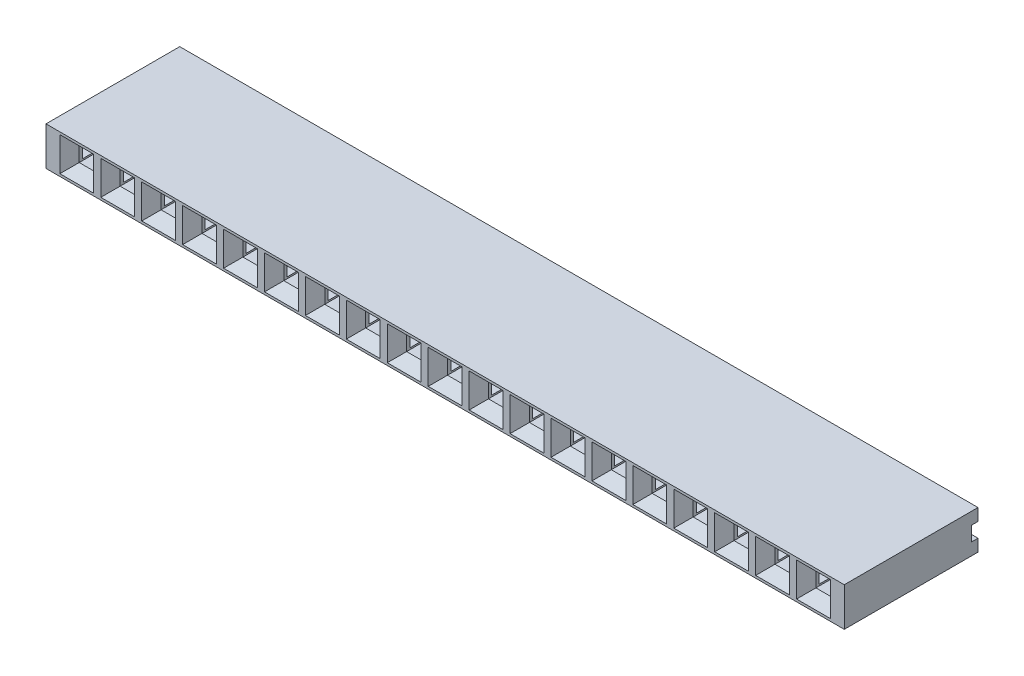
from build123d import *

# Parameters (mm, degrees)
EXTRUDE_710_DEPTH         = 6.7
EXTRUDE_710_DEPTH_BACK    = 0.4
SKETCH_233_W              = 2.54
SKETCH_233_H              = 2.4
SKETCH_764_W              = 2.54
SKETCH_764_H              = 0.75
EXTRUDE_1143_DEPTH        = 0.4
SKETCH_1197_W             = 2.54
SKETCH_1197_H             = 2.4
SKETCH_1197_W_2           = 0.9
SKETCH_1197_H_2           = 0.9
EXTRUDE_1482_DEPTH        = 0.8
CHAMFER_1543_SIZE         = 0.6
PATTERN_LINEAR_1669_COUNT = 19
PATTERN_LINEAR_1669_PITCH = 2.54
EXTRUDE_1_DEPTH           = 0.64
EXTRUDE_START             = -48.9
EXTRUDE_2_DEPTH           = 0.64


with BuildPart() as part:
    # Sketch 233 → Extrude 710 (new, two sides: drawn at the far end of the back side and taken through both)
    with BuildSketch(Plane.XY.offset(-EXTRUDE_710_DEPTH_BACK)):
        Rectangle(SKETCH_233_W, SKETCH_233_H)
        Polygon((-1, 0.35), (-0.45, 0.35), (-0.45, 0.45), (0.45, 0.45), (0.45, 0.35), (1, 0.35), (1, -0.35), (0.45, -0.35), (0.45, -0.45), (-0.45, -0.45), (-0.45, -0.35), (-1, -0.35), align=None, mode=Mode.SUBTRACT)
    extrude(amount=EXTRUDE_710_DEPTH + EXTRUDE_710_DEPTH_BACK)

    # Sketch 764 → Extrude 1143 (add)
    with BuildSketch(Plane(origin=(0, 0, -0.4), x_dir=(-1, 0, 0), z_dir=(0, 0, -1))):
        with Locations((0, -0.825)):
            Rectangle(SKETCH_764_W, SKETCH_764_H)
        with Locations((0, 0.825)):
            Rectangle(SKETCH_764_W, SKETCH_764_H)
    extrude(amount=EXTRUDE_1143_DEPTH)

    # Sketch 1197 → Extrude 1482 (add)
    with BuildSketch(Plane.XY.offset(6.7)):
        Rectangle(SKETCH_1197_W, SKETCH_1197_H)
        Rectangle(SKETCH_1197_W_2, SKETCH_1197_H_2, mode=Mode.SUBTRACT)
    extrude(amount=EXTRUDE_1482_DEPTH)

    # Chamfer 1543
    chamfer_1543_edges = [part.edges().sort_by_distance(p)[0] for p in [
        (0.45, 0, 7.5),
        (0, 0.45, 7.5),
        (-0.45, 0, 7.5),
        (0, -0.45, 7.5),
    ]]
    chamfer(chamfer_1543_edges, length=CHAMFER_1543_SIZE)


with BuildPart() as pattern_linear_1669_1:
    # Pattern Linear 1669: pattern copy
    add(part.part.moved(Location(Vector(-1, 0, 0) * (1 * PATTERN_LINEAR_1669_PITCH))))


with BuildPart() as pattern_linear_1669_2:
    # Pattern Linear 1669: pattern copy
    add(part.part.moved(Location(Vector(-1, 0, 0) * (2 * PATTERN_LINEAR_1669_PITCH))))


with BuildPart() as pattern_linear_1669_3:
    # Pattern Linear 1669: pattern copy
    add(part.part.moved(Location(Vector(-1, 0, 0) * (3 * PATTERN_LINEAR_1669_PITCH))))


with BuildPart() as pattern_linear_1669_4:
    # Pattern Linear 1669: pattern copy
    add(part.part.moved(Location(Vector(-1, 0, 0) * (4 * PATTERN_LINEAR_1669_PITCH))))


with BuildPart() as pattern_linear_1669_5:
    # Pattern Linear 1669: pattern copy
    add(part.part.moved(Location(Vector(-1, 0, 0) * (5 * PATTERN_LINEAR_1669_PITCH))))


with BuildPart() as pattern_linear_1669_6:
    # Pattern Linear 1669: pattern copy
    add(part.part.moved(Location(Vector(-1, 0, 0) * (6 * PATTERN_LINEAR_1669_PITCH))))


with BuildPart() as pattern_linear_1669_7:
    # Pattern Linear 1669: pattern copy
    add(part.part.moved(Location(Vector(-1, 0, 0) * (7 * PATTERN_LINEAR_1669_PITCH))))


with BuildPart() as pattern_linear_1669_8:
    # Pattern Linear 1669: pattern copy
    add(part.part.moved(Location(Vector(-1, 0, 0) * (8 * PATTERN_LINEAR_1669_PITCH))))


with BuildPart() as pattern_linear_1669_9:
    # Pattern Linear 1669: pattern copy
    add(part.part.moved(Location(Vector(-1, 0, 0) * (9 * PATTERN_LINEAR_1669_PITCH))))


with BuildPart() as pattern_linear_1669_10:
    # Pattern Linear 1669: pattern copy
    add(part.part.moved(Location(Vector(-1, 0, 0) * (10 * PATTERN_LINEAR_1669_PITCH))))


with BuildPart() as pattern_linear_1669_11:
    # Pattern Linear 1669: pattern copy
    add(part.part.moved(Location(Vector(-1, 0, 0) * (11 * PATTERN_LINEAR_1669_PITCH))))


with BuildPart() as pattern_linear_1669_12:
    # Pattern Linear 1669: pattern copy
    add(part.part.moved(Location(Vector(-1, 0, 0) * (12 * PATTERN_LINEAR_1669_PITCH))))


with BuildPart() as pattern_linear_1669_13:
    # Pattern Linear 1669: pattern copy
    add(part.part.moved(Location(Vector(-1, 0, 0) * (13 * PATTERN_LINEAR_1669_PITCH))))


with BuildPart() as pattern_linear_1669_14:
    # Pattern Linear 1669: pattern copy
    add(part.part.moved(Location(Vector(-1, 0, 0) * (14 * PATTERN_LINEAR_1669_PITCH))))


with BuildPart() as pattern_linear_1669_15:
    # Pattern Linear 1669: pattern copy
    add(part.part.moved(Location(Vector(-1, 0, 0) * (15 * PATTERN_LINEAR_1669_PITCH))))


with BuildPart() as pattern_linear_1669_16:
    # Pattern Linear 1669: pattern copy
    add(part.part.moved(Location(Vector(-1, 0, 0) * (16 * PATTERN_LINEAR_1669_PITCH))))


with BuildPart() as pattern_linear_1669_17:
    # Pattern Linear 1669: pattern copy
    add(part.part.moved(Location(Vector(-1, 0, 0) * (17 * PATTERN_LINEAR_1669_PITCH))))


with BuildPart() as pattern_linear_1669_18:
    # Pattern Linear 1669: pattern copy
    add(part.part.moved(Location(Vector(-1, 0, 0) * (18 * PATTERN_LINEAR_1669_PITCH))))


with BuildPart() as part_1:
    add(part.part)

    # Combine 1766: union Pattern Linear 1669_17, Pattern Linear 1669_16, Pattern Linear 1669_15, Pattern Linear 1669_14, Pattern Linear 1669_13, Pattern Linear 1669_12, Pattern Linear 1669_11, Pattern Linear 1669_10, Pattern Linear 1669_9, Pattern Linear 1669_8, Pattern Linear 1669_7, Pattern Linear 1669_6, Pattern Linear 1669_5, Pattern Linear 1669_4, Pattern Linear 1669_3, Pattern Linear 1669_2, Pattern Linear 1669_1, Pattern Linear 1669_18
    add(pattern_linear_1669_17.part)
    add(pattern_linear_1669_16.part)
    add(pattern_linear_1669_15.part)
    add(pattern_linear_1669_14.part)
    add(pattern_linear_1669_13.part)
    add(pattern_linear_1669_12.part)
    add(pattern_linear_1669_11.part)
    add(pattern_linear_1669_10.part)
    add(pattern_linear_1669_9.part)
    add(pattern_linear_1669_8.part)
    add(pattern_linear_1669_7.part)
    add(pattern_linear_1669_6.part)
    add(pattern_linear_1669_5.part)
    add(pattern_linear_1669_4.part)
    add(pattern_linear_1669_3.part)
    add(pattern_linear_1669_2.part)
    add(pattern_linear_1669_1.part)
    add(pattern_linear_1669_18.part)

    # Sketch 2570 → Бобышка-БоковаяНакладка1 (add)
    with BuildSketch(Plane(origin=(1.27, 0, 0), x_dir=(0, 0, -1), z_dir=(1, 0, 0))):
        Polygon((0.8, 1.2), (0.8, 0.45), (0.4, 0.45), (0.4, -0.45), (0.8, -0.45), (0.8, -1.2), (-7.5, -1.2), (-7.5, 1.2), align=None)
    extrude(amount=EXTRUDE_1_DEPTH)

    # Эскиз-БоковаяНакладка<2> → Бобышка-БоковаяНакладка2 (add)
    with BuildSketch(Plane(origin=(1.27, 0, 0), x_dir=(0, 0, -1), z_dir=(1, 0, 0)).offset(EXTRUDE_START)):
        Polygon((0.8, 1.2), (0.8, 0.45), (0.4, 0.45), (0.4, -0.45), (0.8, -0.45), (0.8, -1.2), (-7.5, -1.2), (-7.5, 1.2), align=None)
    extrude(amount=EXTRUDE_2_DEPTH)


solid = part_1.part
